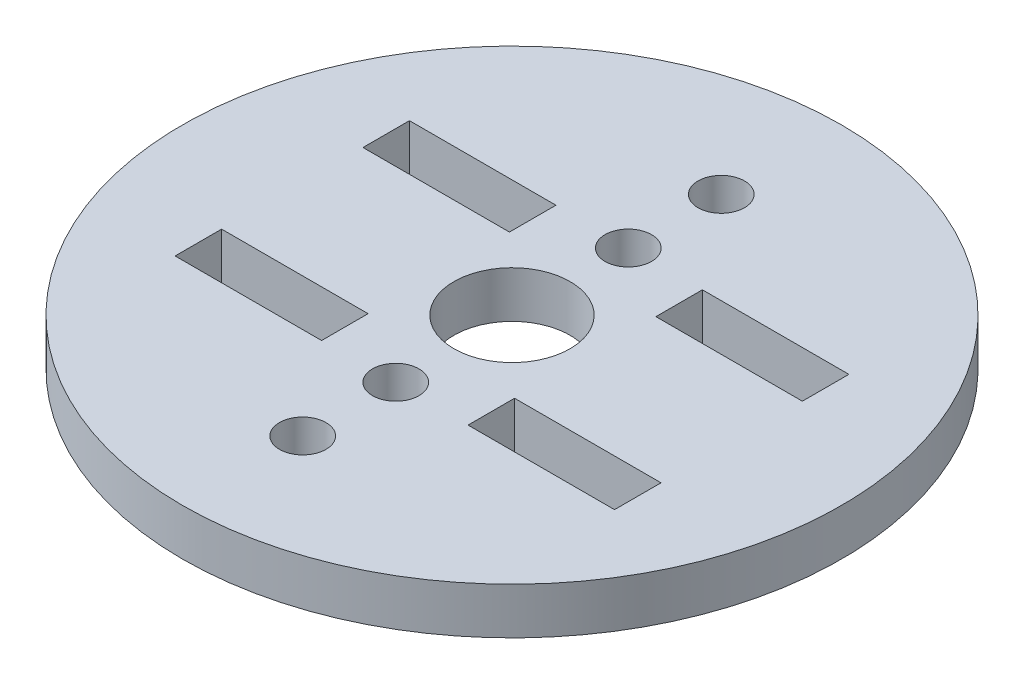
from build123d import *

# Parameters (mm, degrees)
CROQUIS1_R              = 22.5
CROQUIS1_R_2            = 3.96875
CROQUIS1_R_3            = 1.5875
CROQUIS1_W              = 10
CROQUIS1_H              = 3.175
SALIENTE_EXTRUIR1_DEPTH = 3.175


with BuildPart() as part:
    # Croquis1 → Saliente-Extruir1 (new body)
    with BuildSketch(Plane(origin=(0, 0, 0), x_dir=(1, 0, 0), z_dir=(0, 1, 0))):
        with Locations(Location((0, 0, 0), (0, 0, 270))):
            Circle(CROQUIS1_R)
        with Locations(Location((0, 0, 0), (0, 0, 270))):
            Circle(CROQUIS1_R_2, mode=Mode.SUBTRACT)
        with Locations(Location((0, 7.9375, 0), (0, 0, 270))):
            Circle(CROQUIS1_R_3, mode=Mode.SUBTRACT)
        with Locations(Location((0, -7.9375, 0), (0, 0, 270))):
            Circle(CROQUIS1_R_3, mode=Mode.SUBTRACT)
        with Locations(Location((0, 14.2875, 0), (0, 0, 270))):
            Circle(CROQUIS1_R_3, mode=Mode.SUBTRACT)
        with Locations(Location((0, -14.2875, 0), (0, 0, 270))):
            Circle(CROQUIS1_R_3, mode=Mode.SUBTRACT)
        with Locations((-10, 6.4125)):
            Rectangle(CROQUIS1_W, CROQUIS1_H, mode=Mode.SUBTRACT)
        with Locations((10, 6.4125)):
            Rectangle(CROQUIS1_W, CROQUIS1_H, mode=Mode.SUBTRACT)
        with Locations((-10, -6.4125)):
            Rectangle(CROQUIS1_W, CROQUIS1_H, mode=Mode.SUBTRACT)
        with Locations((10, -6.4125)):
            Rectangle(CROQUIS1_W, CROQUIS1_H, mode=Mode.SUBTRACT)
    extrude(amount=SALIENTE_EXTRUIR1_DEPTH)


solid = part.part
